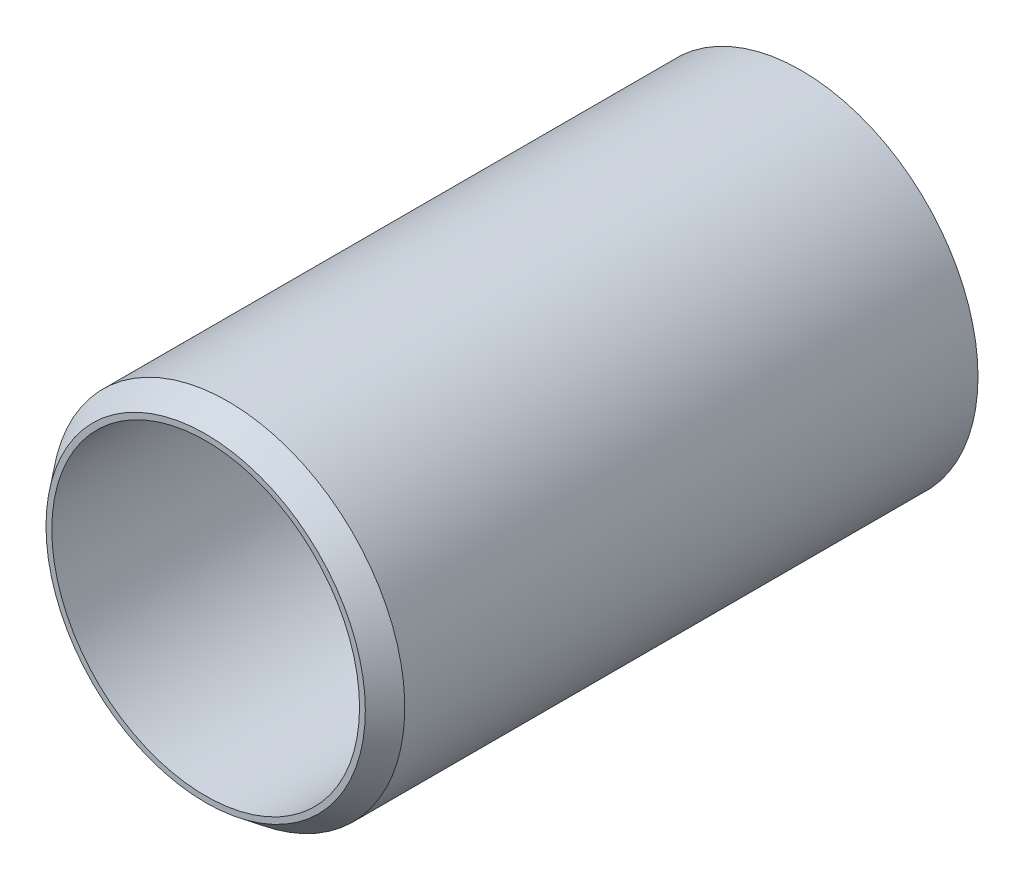
from build123d import *

# Parameters (mm, degrees)
SKETCH1_R      = 30.1625
SKETCH1_R_2    = 26.2509
EXTRUDE1_DEPTH = 50.8
CHAMFER3_SIZE  = 3.81
CHAMFER3_SIZE2 = 2.923515824


with BuildPart() as part:
    # Sketch1 → Extrude1 (new, symmetric)
    with BuildSketch(Plane.XY):
        Circle(SKETCH1_R)
        Circle(SKETCH1_R_2, mode=Mode.SUBTRACT)
    extrude(amount=EXTRUDE1_DEPTH, both=True)

    # Chamfer3
    chamfer3_edges = [part.edges().sort_by_distance(p)[0] for p in [
        (-30.1625, 0, 50.8),
    ]]
    chamfer3_side = [part.faces().sort_by_distance(p)[0] for p in [
        (-30.1625, 0, 0),
    ]]
    chamfer(chamfer3_edges, length=CHAMFER3_SIZE, length2=CHAMFER3_SIZE2, reference=chamfer3_side[0])


solid = part.part
